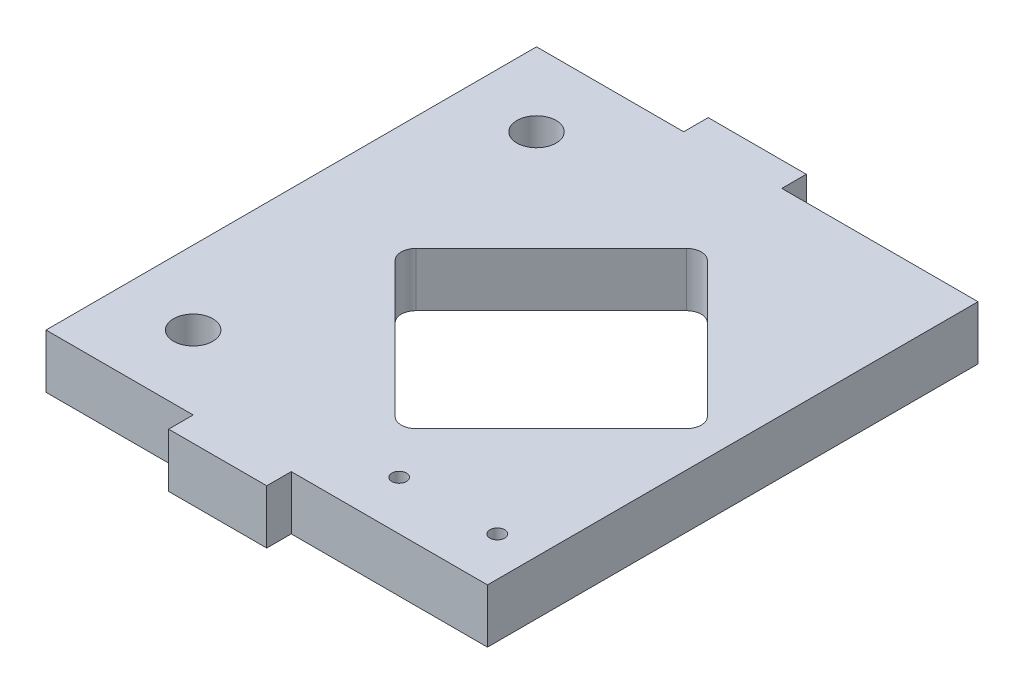
from build123d import *

# Parameters (mm, degrees)
SKETCH1_R           = 4
BOSS_EXTRUDE1_DEPTH = 11
SKETCH2_R           = 1.5
CUT_EXTRUDE1_DEPTH  = 10
CUT_EXTRUDE2_DEPTH  = 11
FILLET1_R           = 3


with BuildPart() as part:
    # Sketch1 → Boss-Extrude1 (new body)
    with BuildSketch(Plane(origin=(0, 0, 0), x_dir=(1, 0, 0), z_dir=(0, 1, 0))):
        Polygon((0, 50), (40, 50), (40, -50), (0, -50), (0, -55), (-20, -55), (-20, -50), (-40, -50), (-50, -50), (-50, 50), (-40, 50), (-20, 50), (-20, 55), (0, 55), align=None)
        with Locations(Location((-35, 35, 0), (0, 0, 270))):
            Circle(SKETCH1_R, mode=Mode.SUBTRACT)
        with Locations(Location((-35, -35, 0), (0, 0, 90))):
            Circle(SKETCH1_R, mode=Mode.SUBTRACT)
    extrude(amount=BOSS_EXTRUDE1_DEPTH)

    # Sketch2 → Cut-Extrude1 (cut)
    with BuildSketch(Plane(origin=(0, 11, 0), x_dir=(1, 0, 0), z_dir=(0, 1, 0))):
        with Locations(Location((32, -40, 0), (0, 0, 270))):
            Circle(SKETCH2_R)
        with Locations(Location((12, -40, 0), (0, 0, 90))):
            Circle(SKETCH2_R)
    extrude(amount=-CUT_EXTRUDE1_DEPTH, mode=Mode.SUBTRACT)

    # Sketch3 → Cut-Extrude2 (cut)
    with BuildSketch(Plane(origin=(0, 11, 0), x_dir=(1, 0, 0), z_dir=(0, 1, 0))):
        Polygon((-28.819805153, 0), (3, -31.819805153), (34.819805153, 0), (3, 31.819805153), align=None)
    extrude(amount=-CUT_EXTRUDE2_DEPTH, mode=Mode.SUBTRACT)

    # Fillet1
    fillet1_edges = [part.edges().sort_by_distance(p)[0] for p in [
        (-28.819805153, 5.5, 0),
        (3, 5.5, -31.819805153),
        (34.819805153, 5.5, 0),
        (3, 5.5, 31.819805153),
    ]]
    fillet(fillet1_edges, radius=FILLET1_R)


solid = part.part
